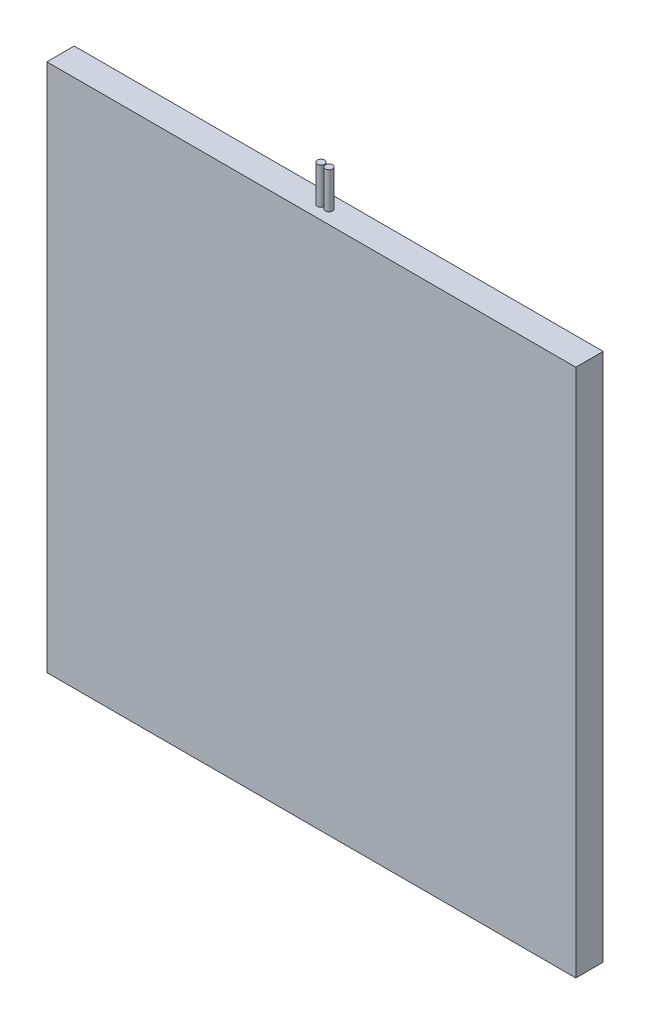
from build123d import *

# Parameters (mm, degrees)
ESQUISSE1_W        = 145
ESQUISSE1_H        = 145
BOSS_EXTRU_1_DEPTH = 5
ESQUISSE2_W        = 26.5
ESQUISSE2_H        = 28
BOSS_EXTRU_2_DEPTH = 2.5
ESQUISSE3_W        = 145
ESQUISSE3_H        = 145
ESQUISSE3_W_2      = 139
ESQUISSE3_H_2      = 139
BOSS_EXTRU_3_DEPTH = 2.5
ESQUISSE4_R        = 1
BOSS_EXTRU_4_DEPTH = 10


with BuildPart() as part:
    # Esquisse1 → Boss.-Extru.1 (new body)
    with BuildSketch(Plane.XY):
        Rectangle(ESQUISSE1_W, ESQUISSE1_H)
    extrude(amount=BOSS_EXTRU_1_DEPTH)

    # Esquisse2 → Boss.-Extru.2 (add)
    with BuildSketch(Plane(origin=(0, 0, 0), x_dir=(-1, 0, 0), z_dir=(0, 0, -1))):
        Polygon((-14.5, -48), (12, -48), (12, -72.5), (14.5, -72.5), (14.5, -48), (41, -48), (41, -72.5), (43.5, -72.5), (43.5, -48), (72.5, -48), (72.5, -45.5), (43.5, -45.5), (43.5, -17.5), (72.5, -17.5), (72.5, -15), (43.5, -15), (43.5, 13), (72.5, 13), (72.5, 15.5), (43.5, 15.5), (43.5, 43.5), (72.5, 43.5), (72.5, 46), (43.5, 46), (43.5, 72.5), (41, 72.5), (41, 46), (14.5, 46), (14.5, 72.5), (12, 72.5), (12, 46), (-14.5, 46), (-14.5, 72.5), (-17, 72.5), (-17, 46), (-43.5, 46), (-43.5, 72.5), (-46, 72.5), (-46, 46), (-72.5, 46), (-72.5, 43.5), (-46, 43.5), (-46, 15.5), (-72.5, 15.5), (-72.5, 13), (-46, 13), (-46, -15), (-72.5, -15), (-72.5, -17.5), (-46, -17.5), (-46, -45.5), (-72.5, -45.5), (-72.5, -48), (-46, -48), (-46, -72.5), (-43.5, -72.5), (-43.5, -48), (-17, -48), (-17, -72.5), (-14.5, -72.5), align=None)
        with Locations((27.75, -31.5)):
            Rectangle(ESQUISSE2_W, ESQUISSE2_H, mode=Mode.SUBTRACT)
        with Locations((-30.25, -31.5)):
            Rectangle(ESQUISSE2_W, ESQUISSE2_H, mode=Mode.SUBTRACT)
        with Locations((-1.25, -31.5)):
            Rectangle(ESQUISSE2_W, ESQUISSE2_H, mode=Mode.SUBTRACT)
        with Locations((-30.25, -1)):
            Rectangle(ESQUISSE2_W, ESQUISSE2_H, mode=Mode.SUBTRACT)
        with Locations((-30.25, 29.5)):
            Rectangle(ESQUISSE2_W, ESQUISSE2_H, mode=Mode.SUBTRACT)
        with Locations((-1.25, -1)):
            Rectangle(ESQUISSE2_W, ESQUISSE2_H, mode=Mode.SUBTRACT)
        with Locations((27.75, -1)):
            Rectangle(ESQUISSE2_W, ESQUISSE2_H, mode=Mode.SUBTRACT)
        with Locations((-1.25, 29.5)):
            Rectangle(ESQUISSE2_W, ESQUISSE2_H, mode=Mode.SUBTRACT)
        with Locations((27.75, 29.5)):
            Rectangle(ESQUISSE2_W, ESQUISSE2_H, mode=Mode.SUBTRACT)
    extrude(amount=BOSS_EXTRU_2_DEPTH)

    # Esquisse3 → Boss.-Extru.3 (add)
    with BuildSketch(Plane(origin=(0, 0, 0), x_dir=(-1, 0, 0), z_dir=(0, 0, -1))):
        Rectangle(ESQUISSE3_W, ESQUISSE3_H)
        Rectangle(ESQUISSE3_W_2, ESQUISSE3_H_2, mode=Mode.SUBTRACT)
    extrude(amount=BOSS_EXTRU_3_DEPTH)

    # Esquisse4 → Boss.-Extru.4 (add)
    with BuildSketch(Plane(origin=(0, 72.5, 0), x_dir=(1, 0, 0), z_dir=(0, 1, 0))):
        with Locations(Location((-1.1, -1.25, 0), (0, 0, 90))):
            Circle(ESQUISSE4_R)
        with Locations(Location((1.1, -1.25, 0), (0, 0, 90))):
            Circle(ESQUISSE4_R)
    extrude(amount=BOSS_EXTRU_4_DEPTH)


solid = part.part
